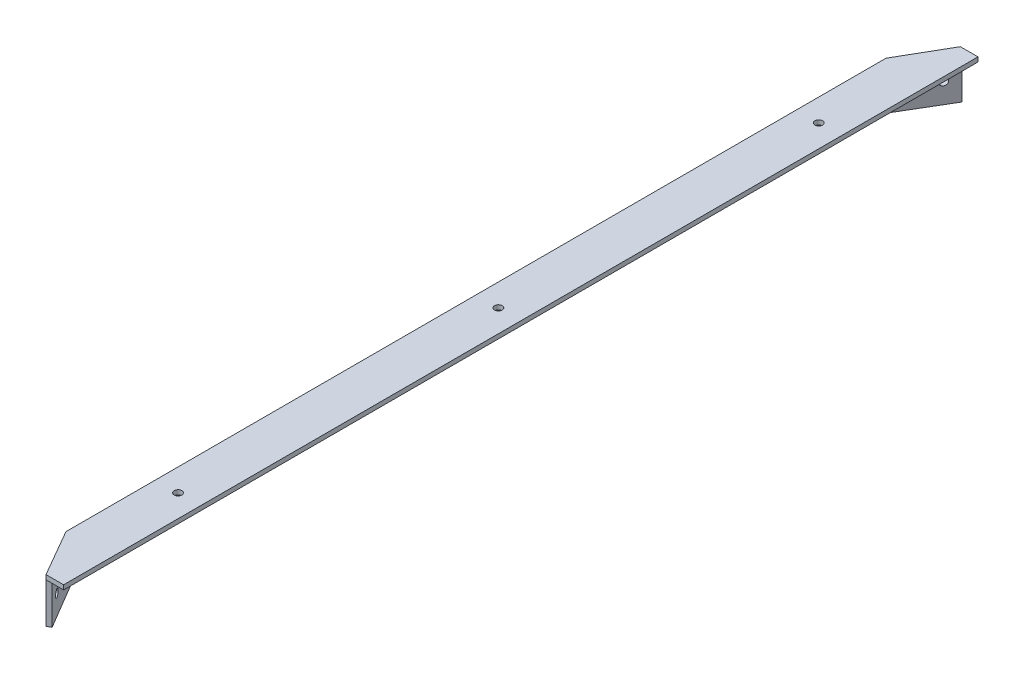
from build123d import *
from build123d.topology import SkipClean

# Parameters (mm, degrees)
BOSS_EXTRUDE1_DEPTH = 640
SKETCH22_R          = 6
CUT_EXTRUDE4_DEPTH  = 10
BOSS_EXTRUDE2_DEPTH = 63
BOSS_EXTRUDE3_DEPTH = 7
SKETCH26_R          = 6
CUT_EXTRUDE5_DEPTH  = 7


with BuildPart() as part:
    # Sketch1 → Boss-Extrude1 (new body)
    with BuildSketch(Plane.XY):
        Polygon((0, 0), (0, 70), (70, 70), (70, 63), (7, 63), (7, 0), align=None)
    extrude(amount=BOSS_EXTRUDE1_DEPTH)

    # Sketch22 → Cut-Extrude4 (cut)
    with BuildSketch(Plane(origin=(0, 70, 0), x_dir=(1, 0, 0), z_dir=(0, 1, 0))):
        with Locations((35, 0)):
            Circle(SKETCH22_R)
        with Locations((35, 500)):
            Circle(SKETCH22_R)
        with Locations(Location((35, -500, 0), (0, 0, 270))):
            Circle(SKETCH22_R)
    extrude(amount=-CUT_EXTRUDE4_DEPTH, mode=Mode.SUBTRACT)

    # Sketch23 → Boss-Extrude2 (add)
    with BuildSketch(Plane(origin=(0, 0, 0), x_dir=(1, 0, 0), z_dir=(0, 1, 0))):
        Polygon((0, -640), (42.5, -713.612159322), (48.562177826, -710.112159322), (7, -640), align=None)
    extrude(amount=BOSS_EXTRUDE2_DEPTH)

    # Sketch25 → Boss-Extrude3 (add)
    with BuildSketch(Plane(origin=(0, 63, 0), x_dir=(1, 0, 0), z_dir=(0, 1, 0))):
        Polygon((70, -640), (0, -640), (42.5, -713.612159322), (70, -713.612159322), align=None)
    extrude(amount=BOSS_EXTRUDE3_DEPTH)

    # Sketch26 → Cut-Extrude5 (cut)
    with BuildSketch(Plane(origin=(-275.556719825, 0, 163.348804279), x_dir=(-0.5099316128113042, 0, -0.8602149442178172), z_dir=(0.8602149442178172, 0, -0.5099316128113042))):
        with Locations((-614.36248118, 31.5)):
            Circle(SKETCH26_R)
        with Locations((-575.357085589, 31.5)):
            Circle(SKETCH26_R)
    extrude(amount=-CUT_EXTRUDE5_DEPTH, mode=Mode.SUBTRACT)

    # Mirror1: part across plane


with BuildPart() as part_1:
    with SkipClean():  # the faces are left unmerged after this step: merging them gives an invalid solid
        add(part.part)
        add(part.part.mirror(Plane.XY))


solid = part_1.part
